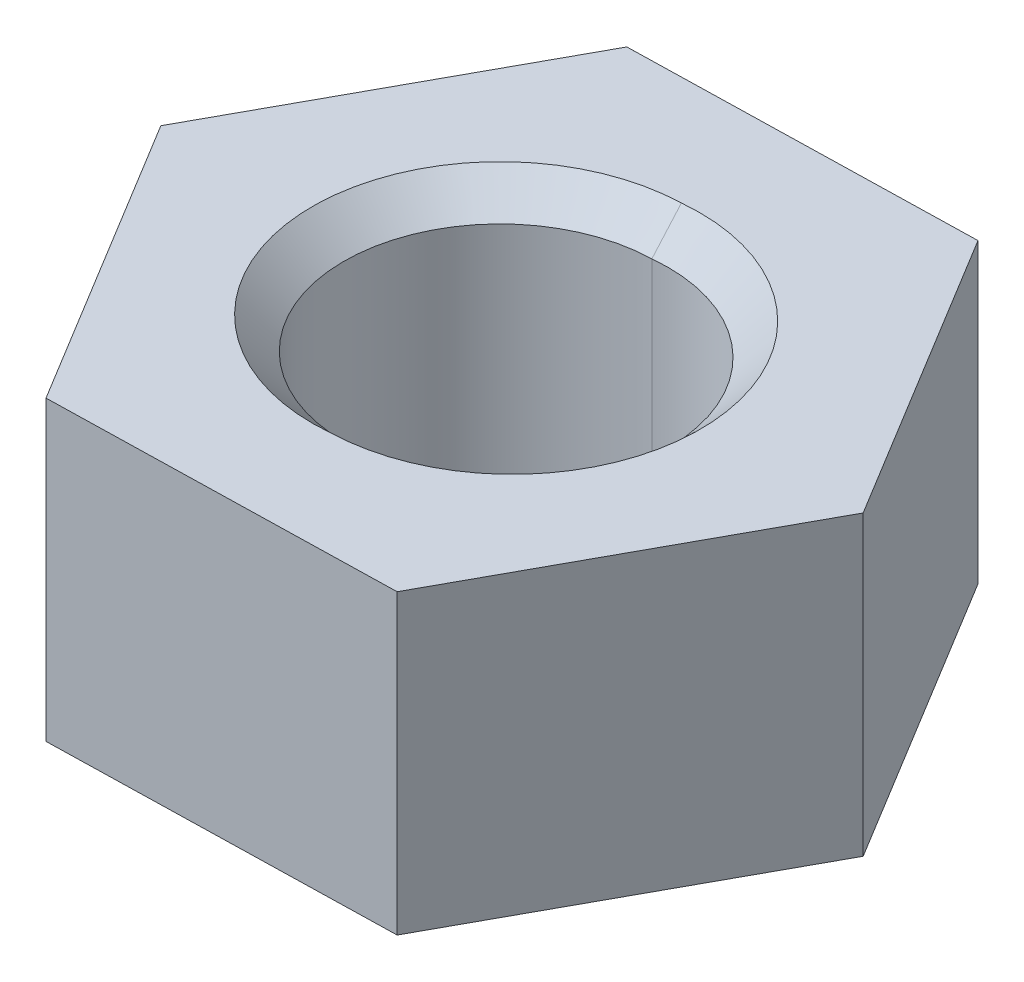
from build123d import *

# Parameters (mm, degrees)
BOSS_EXTRUDE2_DEPTH         = 4
M5_TAPPED_HOLE3_D           = 4.2
M5_TAPPED_HOLE3_CSINK_D     = 5.05
M5_TAPPED_HOLE3_CSINK_ANGLE = 90


with BuildPart() as part:
    # Sketch8 → Boss-Extrude2 (new body)
    with BuildSketch(Plane(origin=(0, 0, 0), x_dir=(1, 0, 0), z_dir=(0, 1, 0))):
        Polygon((2.400826816, -3.945803332), (4.617579332, 0.106275347), (2.216752516, 4.052078679), (-2.400826816, 3.945803332), (-4.617579332, -0.106275347), (-2.216752516, -4.052078679), align=None)
    extrude(amount=BOSS_EXTRUDE2_DEPTH)

    # M5 Tapped Hole3 (through all)
    with Locations(Plane(origin=(-0.132343684, 4, 0.02883036), x_dir=(0, 0, 1), z_dir=(0, 1, 0))):
        with Locations((0, 0), (-0.009914208, 0.154917862)):
            CounterSinkHole(M5_TAPPED_HOLE3_D / 2, M5_TAPPED_HOLE3_CSINK_D / 2, counter_sink_angle=M5_TAPPED_HOLE3_CSINK_ANGLE)


solid = part.part
